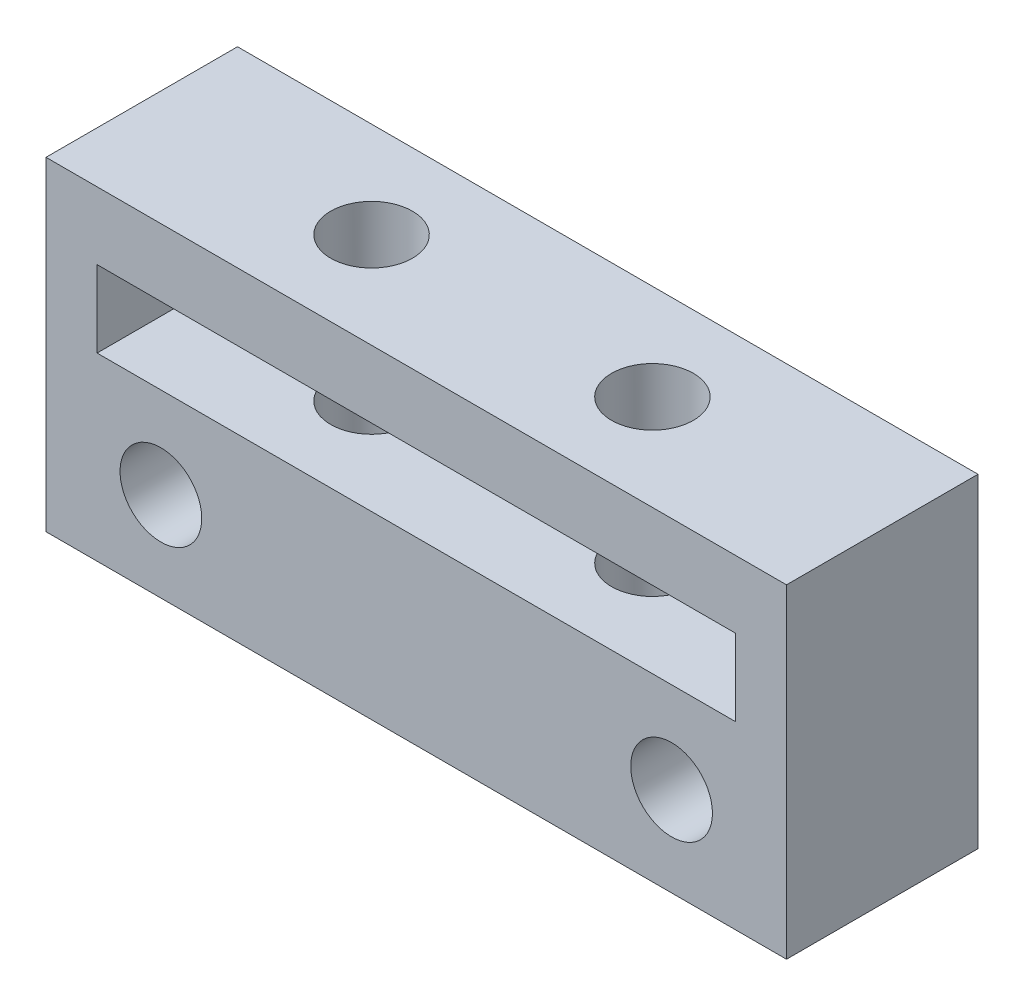
from build123d import *

# Parameters (mm, degrees)
SKETCH_1_W          = 29
SKETCH_1_H          = 19.2
EXTRUDE_1_DEPTH     = 7.5
SKETCH_2_R          = 1.6
CUT_EXTRUDE_1_DEPTH = 19.938320939
SKETCH_3_W          = 25
SKETCH_3_H          = 3
CUT_EXTRUDE_2_DEPTH = 7.5
SKETCH_4_R          = 1.6
CUT_EXTRUDE_3_DEPTH = 26.201984049
SKETCH_6_W          = 29
SKETCH_6_H          = 6.5
CUT_EXTRUDE_5_DEPTH = 19.938320939
SKETCH_7_R          = 2.6
SKETCH_7_R_2        = 1.6
CUT_EXTRUDE_6_DEPTH = 1.5


with BuildPart() as part:
    # 草图1 → 凸台-拉伸1 (new body)
    with BuildSketch(Plane.XY):
        Rectangle(SKETCH_1_W, SKETCH_1_H)
    extrude(amount=EXTRUDE_1_DEPTH)

    # 草图2 → 切除-拉伸1 (cut, through all)
    with BuildSketch(Plane.XY.offset(7.5)):
        with Locations((10, -6.1)):
            Circle(SKETCH_2_R)
        with Locations((-10, -6.1)):
            Circle(SKETCH_2_R)
    extrude(amount=-CUT_EXTRUDE_1_DEPTH, mode=Mode.SUBTRACT)

    # 草图3 → 切除-拉伸2 (cut)
    with BuildSketch(Plane.XY.offset(7.5)):
        with Locations((0, -1.0394817)):
            Rectangle(SKETCH_3_W, SKETCH_3_H)
    extrude(amount=-CUT_EXTRUDE_2_DEPTH, mode=Mode.SUBTRACT)

    # 草图4 → 切除-拉伸3 (cut, through all)
    with BuildSketch(Plane.XZ.offset(9.6)):
        with Locations(Location((-5.5, 3.75, 0), (0, 0, 270))):
            Circle(SKETCH_4_R)
        with Locations(Location((5.5, 3.75, 0), (0, 0, 270))):
            Circle(SKETCH_4_R)
    extrude(amount=-CUT_EXTRUDE_3_DEPTH, mode=Mode.SUBTRACT)

    # 草图6 → 切除-拉伸5 (cut, through all)
    with BuildSketch(Plane.XY.offset(7.5)):
        with Locations((0, 6.35)):
            Rectangle(SKETCH_6_W, SKETCH_6_H)
    extrude(amount=-CUT_EXTRUDE_5_DEPTH, mode=Mode.SUBTRACT)

    # 草图7 → 切除-拉伸6 (cut)
    # profile 1 of 2: a face of its own
    with BuildSketch(Plane.XZ.offset(9.6)):
        with Locations(Location((-5.5, 3.75, 0), (0, 0, 270))):
            Circle(SKETCH_7_R)
        with Locations(Location((-5.5, 3.75, 0), (0, 0, 270))):
            Circle(SKETCH_7_R_2, mode=Mode.SUBTRACT)
    # profile 2 of 2: a face of its own
    with BuildSketch(Plane.XZ.offset(9.6)):
        with Locations(Location((5.5, 3.75, 0), (0, 0, 270))):
            Circle(SKETCH_7_R)
        with Locations(Location((5.5, 3.75, 0), (0, 0, 270))):
            Circle(SKETCH_7_R_2, mode=Mode.SUBTRACT)
    extrude(amount=-CUT_EXTRUDE_6_DEPTH, mode=Mode.SUBTRACT)


solid = part.part
